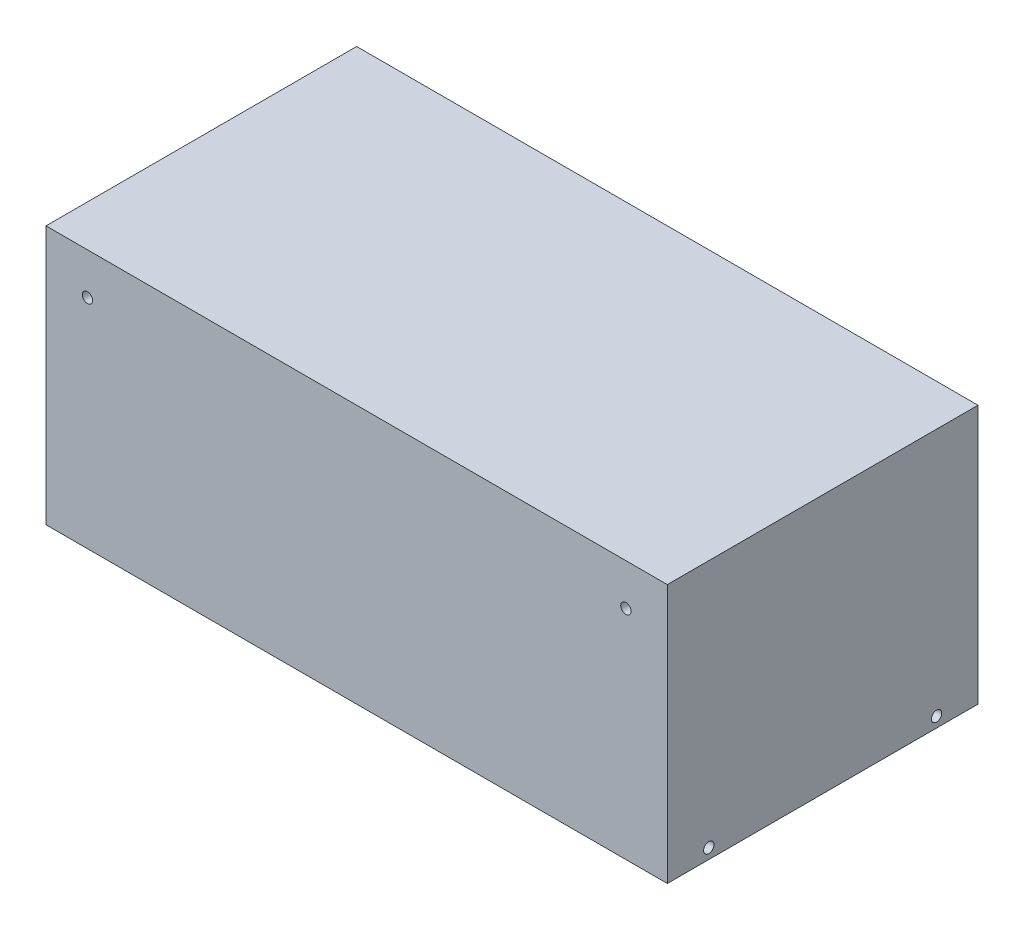
from build123d import *

# Parameters (mm, degrees)
SKETCH1_W           = 300
SKETCH1_H           = 150
BOSS_EXTRUDE1_DEPTH = 125
SKETCH2_W           = 270
SKETCH2_H           = 120
CUT_EXTRUDE1_DEPTH  = 110
SKETCH4_R           = 2.5
CUT_EXTRUDE5_DEPTH  = 350
SKETCH6_R           = 2.5
CUT_EXTRUDE6_DEPTH  = 175


with BuildPart() as part:
    # Sketch1 → Boss-Extrude1 (new body)
    with BuildSketch(Plane(origin=(0, 0, 0), x_dir=(1, 0, 0), z_dir=(0, 1, 0))):
        Rectangle(SKETCH1_W, SKETCH1_H)
    extrude(amount=BOSS_EXTRUDE1_DEPTH)

    # Sketch2 → Cut-Extrude1 (cut)
    with BuildSketch(Plane.XZ):
        Rectangle(SKETCH2_W, SKETCH2_H)
    extrude(amount=-CUT_EXTRUDE1_DEPTH, mode=Mode.SUBTRACT)

    # Sketch4 → Cut-Extrude5 (cut)
    with BuildSketch(Plane(origin=(150, 0, 0), x_dir=(0, 0, -1), z_dir=(1, 0, 0))):
        with Locations((-55, 5)):
            Circle(SKETCH4_R)
        with Locations((55, 5)):
            Circle(SKETCH4_R)
    extrude(amount=-CUT_EXTRUDE5_DEPTH, mode=Mode.SUBTRACT)

    # Sketch6 → Cut-Extrude6 (cut)
    with BuildSketch(Plane.XY.offset(75)):
        with Locations((-130, 105)):
            Circle(SKETCH6_R)
        with Locations((130, 105)):
            Circle(SKETCH6_R)
    extrude(amount=-CUT_EXTRUDE6_DEPTH, mode=Mode.SUBTRACT)


solid = part.part
